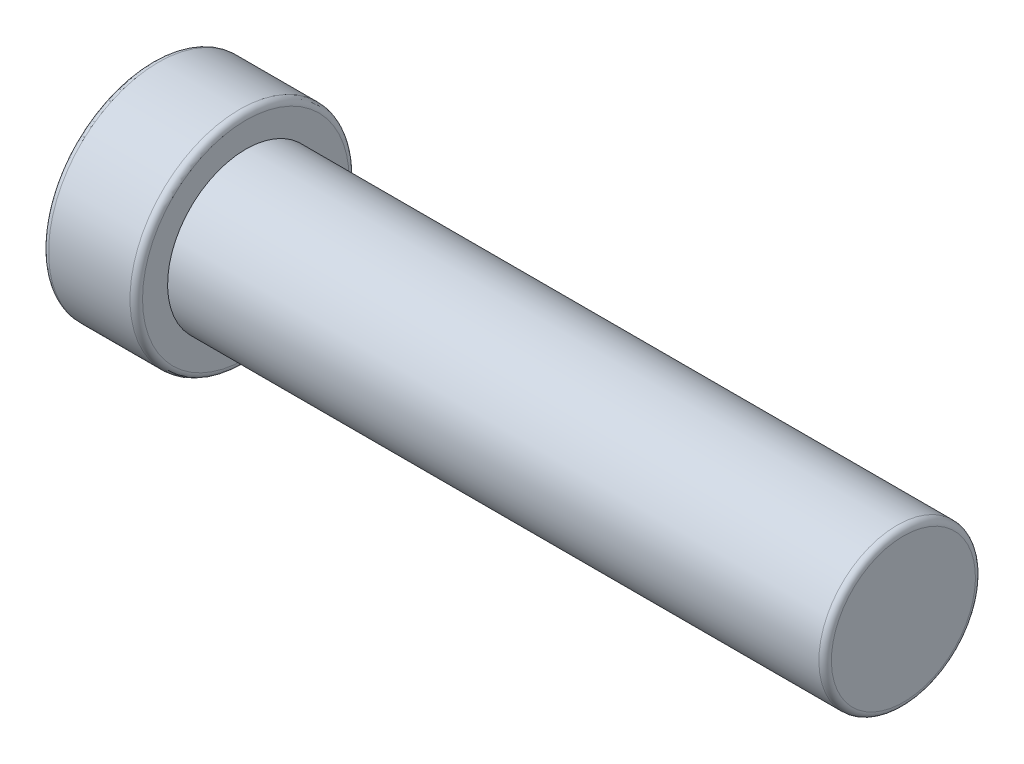
from build123d import *

# Parameters (mm, degrees)
FILLET1_R          = 0.2
CUT_EXTRUDE1_DEPTH = 3


with BuildPart() as part:
    # Sketch1 → Revolve1 (revolve)
    with BuildSketch(Plane.XY):
        Polygon((0, 0), (-24, 0), (-24, 3.5), (-21, 3.5), (-21, 2.5), (0, 2.5), align=None)
    revolve(axis=Axis((0, 0, 0), (-1, 0, 0)))

    # Fillet1
    fillet1_edges = [part.edges().sort_by_distance(p)[0] for p in [
        (0, -2.5, 0),
        (-21, -3.5, 0),
        (-24, -3.5, 0),
    ]]
    fillet(fillet1_edges, radius=FILLET1_R)

    # Sketch2 → Cut-Extrude1 (cut)
    with BuildSketch(Plane.ZY.offset(24)):
        Polygon((0, 2), (-1.732050808, 1), (-1.732050808, -1), (0, -2), (1.732050808, -1), (1.732050808, 1), align=None)
    extrude(amount=-CUT_EXTRUDE1_DEPTH, mode=Mode.SUBTRACT)


solid = part.part
